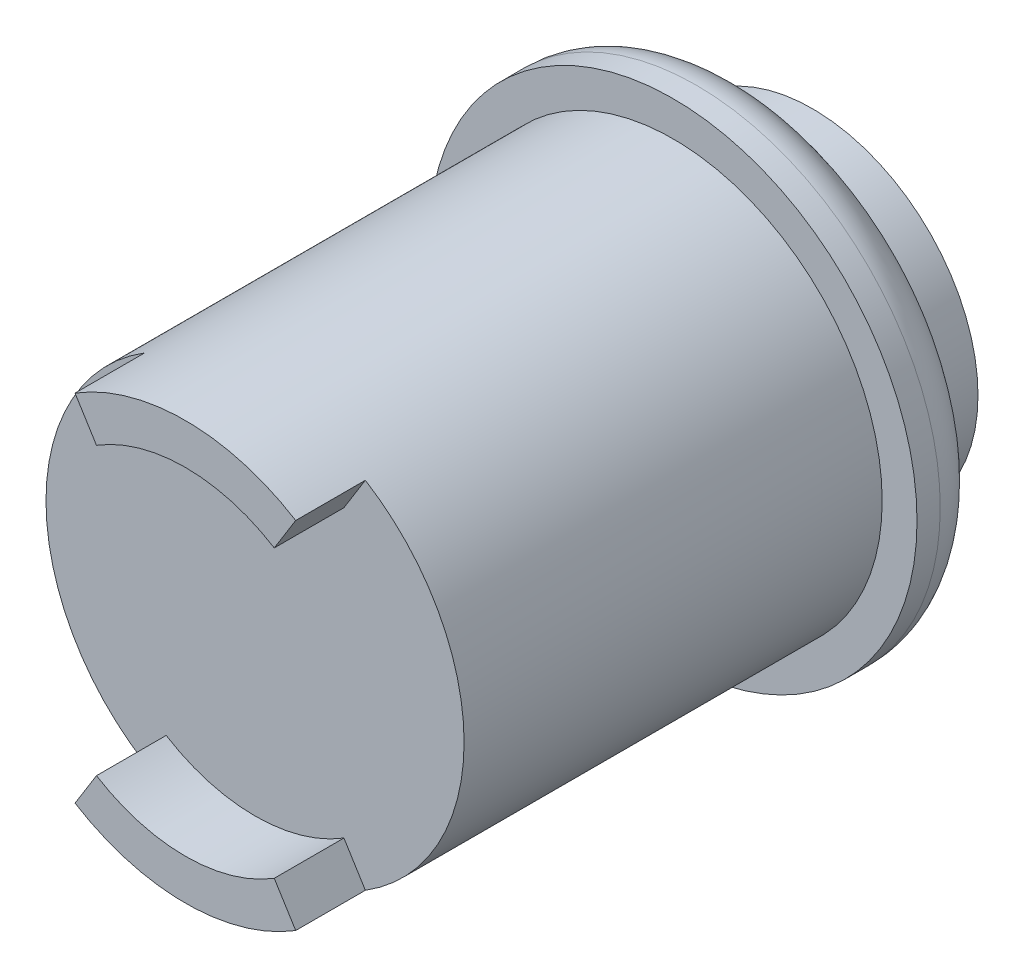
from build123d import *

# Parameters (mm, degrees)
SKETCH1_R           = 14.2875
BOSS_EXTRUDE1_DEPTH = 33.3375
SKETCH2_R           = 16.66875
BOSS_EXTRUDE2_DEPTH = 4.7625
FILLET1_R           = 3.175
SKETCH3_R           = 11.3109375
BOSS_EXTRUDE3_DEPTH = 4.7625
CUT_EXTRUDE1_START  = -4.7625
CUT_EXTRUDE1_DEPTH  = 4.7625


with BuildPart() as part:
    # Sketch1 → Boss-Extrude1 (new body)
    with BuildSketch(Plane.XY):
        Circle(SKETCH1_R)
    extrude(amount=BOSS_EXTRUDE1_DEPTH)

    # Sketch2 → Boss-Extrude2 (add)
    with BuildSketch(Plane(origin=(0, 0, 0), x_dir=(-1, 0, 0), z_dir=(0, 0, -1))):
        with Locations(Location((0, 0, 0), (0, 0, 180))):
            Circle(SKETCH2_R)
    extrude(amount=BOSS_EXTRUDE2_DEPTH)

    # Fillet1
    fillet1_edges = [part.edges().sort_by_distance(p)[0] for p in [
        (-16.66875, 0, -4.7625),
    ]]
    fillet(fillet1_edges, radius=FILLET1_R)

    # Sketch3 → Boss-Extrude3 (add)
    with BuildSketch(Plane(origin=(0, 0, -4.7625), x_dir=(-1, 0, 0), z_dir=(0, 0, -1))):
        with Locations(Location((0, 0, 0), (0, 0, 180))):
            Circle(SKETCH3_R)
    extrude(amount=BOSS_EXTRUDE3_DEPTH)

    # Sketch4 → Cut-Extrude1 (cut)
    with BuildSketch(Plane.XY.offset(33.3375).offset(CUT_EXTRUDE1_START)):
        with BuildLine():
            Line((-7.540625, 12.135552351), (-6.074392361, 9.775861616))
            ThreePointArc((-6.074392361, 9.775861616), (0, 11.509375), (6.074392361, 9.775861616))
            Line((6.074392361, 9.775861616), (7.540625, 12.135552351))
            ThreePointArc((7.540625, 12.135552351), (14.2875, 0), (7.540625, -12.135552351))
            Line((7.540625, -12.135552351), (6.074392361, -9.775861616))
            ThreePointArc((6.074392361, -9.775861616), (0, -11.509375), (-6.074392361, -9.775861616))
            Line((-6.074392361, -9.775861616), (-7.540625, -12.135552351))
            ThreePointArc((-7.540625, -12.135552351), (-14.2875, 0), (-7.540625, 12.135552351))
        make_face()
    extrude(amount=CUT_EXTRUDE1_DEPTH, mode=Mode.SUBTRACT)


solid = part.part
